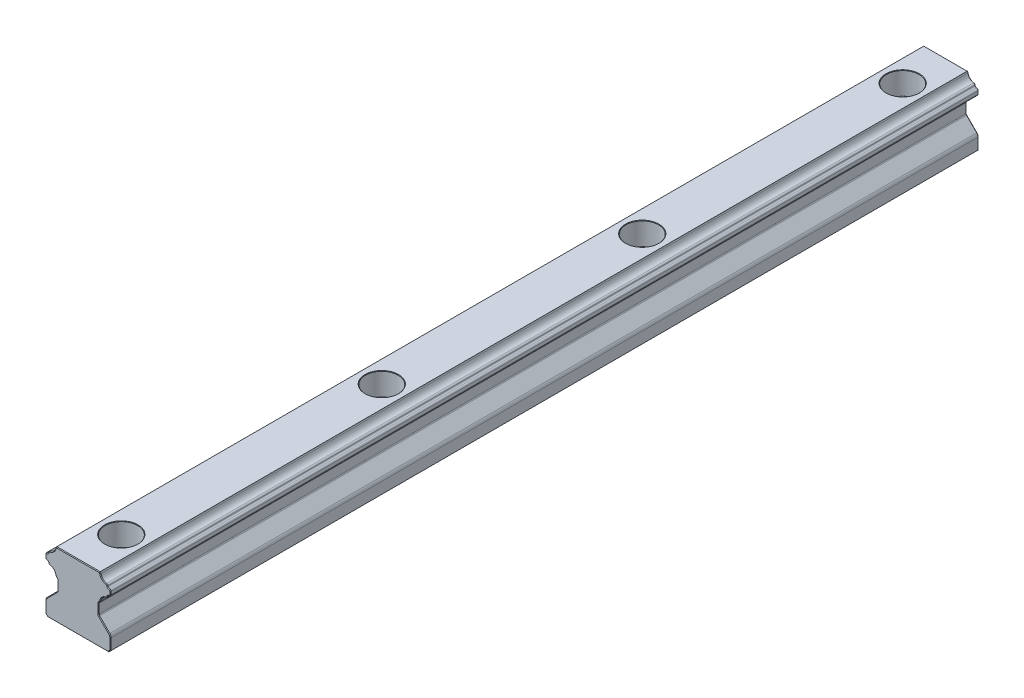
from build123d import *

# Parameters (mm, degrees)
BODY_DEPTH                                 = 200
AESTHETIC_CHAMFER_SIZE                     = 0.15
PRODUCTION_FILLET_R                        = 0.1
MOUNTING_HOLES_PATTERN_COUNT               = 4
MOUNTING_HOLES_PATTERN_PITCH               = 60
PRODUCTION_FILLET_OF_MOUNTING_HOLES_PATT_R = 0.1


with BuildPart() as part:
    # Rail Profile → Body (new body)
    with BuildSketch(Plane.XY):
        with BuildLine():
            Line((-7, 0), (7, 0))
            Line((7, 0), (7.5, 0.5))
            Line((7.5, 0.5), (7.5, 3.085786438))
            ThreePointArc((7.5, 3.085786438), (7.423879533, 3.46846987), (7.207106781, 3.792893219))
            Line((7.207106781, 3.792893219), (4.867157288, 6.132842712))
            ThreePointArc((4.867157288, 6.132842712), (4.780448187, 6.262612052), (4.75, 6.415685425))
            Line((4.75, 6.415685425), (4.75, 8.584314575))
            ThreePointArc((4.75, 8.584314575), (4.780448187, 8.737387948), (4.867157288, 8.867157288))
            Line((4.867157288, 8.867157288), (5.062965362, 9.062965362))
            ThreePointArc((5.062965362, 9.062965362), (5.134996734, 9.161242682), (5.17409812, 9.27664646))
            ThreePointArc((5.17409812, 9.27664646), (5.61862915, 10.13137085), (6.47335354, 10.57590188))
            ThreePointArc((6.47335354, 10.57590188), (6.694124352, 10.694306692), (6.801170165, 10.920803148))
            ThreePointArc((6.801170165, 10.920803148), (6.915305692, 11.154571658), (7.149074202, 11.268707185))
            ThreePointArc((7.149074202, 11.268707185), (7.399691242, 11.400760606), (7.5, 11.665685425))
            Line((7.5, 11.665685425), (7.5, 12.334314575))
            ThreePointArc((7.5, 12.334314575), (7.399691242, 12.599239394), (7.149074202, 12.731292815))
            ThreePointArc((7.149074202, 12.731292815), (6.915305692, 12.845428342), (6.801170165, 13.079196852))
            ThreePointArc((6.801170165, 13.079196852), (6.694124352, 13.305693308), (6.47335354, 13.42409812))
            ThreePointArc((6.47335354, 13.42409812), (5.61862915, 13.86862915), (5.17409812, 14.72335354))
            ThreePointArc((5.17409812, 14.72335354), (5.134996734, 14.838757318), (5.062965362, 14.937034638))
            Line((5.062965362, 14.937034638), (5, 15))
            Line((5, 15), (-5, 15))
            Line((-5, 15), (-5.062965362, 14.937034638))
            ThreePointArc((-5.062965362, 14.937034638), (-5.134996734, 14.838757318), (-5.17409812, 14.72335354))
            ThreePointArc((-5.17409812, 14.72335354), (-5.61862915, 13.86862915), (-6.47335354, 13.42409812))
            ThreePointArc((-6.47335354, 13.42409812), (-6.694124352, 13.305693308), (-6.801170165, 13.079196852))
            ThreePointArc((-6.801170165, 13.079196852), (-6.915305692, 12.845428342), (-7.149074202, 12.731292815))
            ThreePointArc((-7.149074202, 12.731292815), (-7.399691242, 12.599239394), (-7.5, 12.334314575))
            Line((-7.5, 12.334314575), (-7.5, 11.665685425))
            ThreePointArc((-7.5, 11.665685425), (-7.399691242, 11.400760606), (-7.149074202, 11.268707185))
            ThreePointArc((-7.149074202, 11.268707185), (-6.915305692, 11.154571658), (-6.801170165, 10.920803148))
            ThreePointArc((-6.801170165, 10.920803148), (-6.694124352, 10.694306692), (-6.47335354, 10.57590188))
            ThreePointArc((-6.47335354, 10.57590188), (-5.61862915, 10.13137085), (-5.17409812, 9.27664646))
            ThreePointArc((-5.17409812, 9.27664646), (-5.134996734, 9.161242682), (-5.062965362, 9.062965362))
            Line((-5.062965362, 9.062965362), (-4.867157288, 8.867157288))
            ThreePointArc((-4.867157288, 8.867157288), (-4.780448187, 8.737387948), (-4.75, 8.584314575))
            Line((-4.75, 8.584314575), (-4.75, 6.415685425))
            ThreePointArc((-4.75, 6.415685425), (-4.780448187, 6.262612052), (-4.867157288, 6.132842712))
            Line((-4.867157288, 6.132842712), (-7.207106781, 3.792893219))
            ThreePointArc((-7.207106781, 3.792893219), (-7.423879533, 3.46846987), (-7.5, 3.085786438))
            Line((-7.5, 3.085786438), (-7.5, 0.5))
            Line((-7.5, 0.5), (-7, 0))
        make_face()
    extrude(amount=-BODY_DEPTH)

    # Aesthetic Chamfer
    aesthetic_chamfer_edges = [part.edges().sort_by_distance(p)[0] for p in [
        (7.423879533, 3.46846987, -200),
        (-5.134996734, 9.161242682, -200),
        (-4.965061325, 8.965061325, -200),
        (-4.780448187, 8.737387948, -200),
        (-4.75, 7.5, -200),
        (-4.780448187, 6.262612052, -200),
        (-6.037132034, 4.962867966, -200),
        (-7.423879533, 3.46846987, -200),
        (-7.5, 1.792893219, -200),
        (-7.25, 0.25, -200),
        (0, 0, -200),
        (6.037132034, 4.962867966, -200),
        (4.780448187, 6.262612052, -200),
        (4.75, 7.5, -200),
        (4.780448187, 8.737387948, -200),
        (4.965061325, 8.965061325, -200),
        (5.134996734, 9.161242682, -200),
        (5.61862915, 10.13137085, -200),
        (6.694124352, 10.694306692, -200),
        (0, 0, 0),
        (-7.25, 0.25, 0),
        (-7.5, 1.792893219, 0),
        (-7.423879533, 3.46846987, 0),
        (-6.037132034, 4.962867966, 0),
        (-4.780448187, 6.262612052, 0),
        (6.915305692, 11.154571658, -200),
        (-4.75, 7.5, 0),
        (-4.780448187, 8.737387948, 0),
        (-4.965061325, 8.965061325, 0),
        (-5.134996734, 9.161242682, 0),
        (-5.61862915, 10.13137085, 0),
        (-6.694124352, 10.694306692, 0),
        (-6.915305692, 11.154571658, 0),
        (7.25, 0.25, -200),
        (7.399691242, 11.400760606, -200),
        (-7.399691242, 11.400760606, 0),
        (-7.5, 12, 0),
        (-7.399691242, 12.599239394, 0),
        (-6.915305692, 12.845428342, 0),
        (-6.694124352, 13.305693308, 0),
        (-5.61862915, 13.86862915, 0),
        (-5.134996734, 14.838757318, 0),
        (-5.031482681, 14.968517319, 0),
        (7.5, 12, -200),
        (0, 15, 0),
        (5.031482681, 14.968517319, 0),
        (5.134996734, 14.838757318, 0),
        (5.61862915, 13.86862915, 0),
        (6.694124352, 13.305693308, 0),
        (6.915305692, 12.845428342, 0),
        (7.399691242, 12.599239394, 0),
        (7.399691242, 12.599239394, -200),
        (7.5, 12, 0),
        (7.399691242, 11.400760606, 0),
        (6.915305692, 11.154571658, 0),
        (6.694124352, 10.694306692, 0),
        (5.61862915, 10.13137085, 0),
        (5.134996734, 9.161242682, 0),
        (4.965061325, 8.965061325, 0),
        (4.780448187, 8.737387948, 0),
        (6.915305692, 12.845428342, -200),
        (4.75, 7.5, 0),
        (4.780448187, 6.262612052, 0),
        (6.037132034, 4.962867966, 0),
        (7.423879533, 3.46846987, 0),
        (7.5, 1.792893219, 0),
        (7.25, 0.25, 0),
        (6.694124352, 13.305693308, -200),
        (5.61862915, 13.86862915, -200),
        (5.134996734, 14.838757318, -200),
        (5.031482681, 14.968517319, -200),
        (0, 15, -200),
        (-5.031482681, 14.968517319, -200),
        (7.5, 1.792893219, -200),
        (-5.134996734, 14.838757318, -200),
        (-5.61862915, 13.86862915, -200),
        (-6.694124352, 13.305693308, -200),
        (-6.915305692, 12.845428342, -200),
        (-7.399691242, 12.599239394, -200),
        (-7.5, 12, -200),
        (-7.399691242, 11.400760606, -200),
        (-6.915305692, 11.154571658, -200),
        (-6.694124352, 10.694306692, -200),
        (-5.61862915, 10.13137085, -200),
    ]]
    chamfer(aesthetic_chamfer_edges, length=AESTHETIC_CHAMFER_SIZE)

    # Sketch1 → Mounting Hole (revolve, cut)
    with BuildSketch(Plane(origin=(0, 15, -10), x_dir=(0, 0, 1), z_dir=(1, 0, 0))):
        Polygon((0, 0), (0, 15), (2.35, 15), (2.25, 14.9), (2.25, 5.4), (2.35, 5.3), (3.75, 5.3), (3.75, 0.1), (3.85, 0), align=None)
    mounting_hole = revolve(axis=Axis((0, 21.35, -10), (0, -1, 0)), mode=Mode.SUBTRACT)

    # Production Fillet
    production_fillet_edges = [part.edges().sort_by_distance(p)[0] for p in [
        (0, 9.7, -13.75),
    ]]
    fillet(production_fillet_edges, radius=PRODUCTION_FILLET_R)

    # Mounting Holes Pattern: Mounting Hole ×4
    with Locations(*[(0, 0, -i * MOUNTING_HOLES_PATTERN_PITCH) for i in range(1, MOUNTING_HOLES_PATTERN_COUNT)]):
        add(mounting_hole, mode=Mode.SUBTRACT)

    # Production Fillet of Mounting Holes Patt
    production_fillet_of_mounting_holes_patt_edges = [part.edges().sort_by_distance(p)[0] for p in [
        (0, 9.7, -73.75),
        (0, 9.7, -133.75),
        (0, 9.7, -193.75),
    ]]
    fillet(production_fillet_of_mounting_holes_patt_edges, radius=PRODUCTION_FILLET_OF_MOUNTING_HOLES_PATT_R)


solid = part.part
